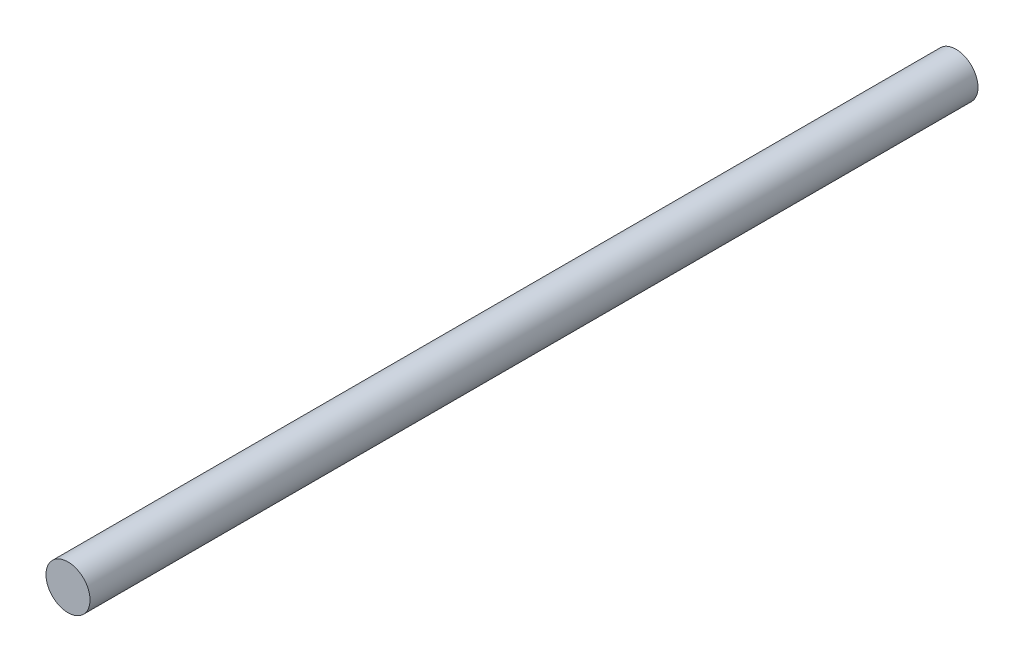
from build123d import *

# Parameters (mm, degrees)
SKETCH2_R           = 1.985
BOSS_EXTRUDE1_DEPTH = 80


with BuildPart() as part:
    # Sketch2 → Boss-Extrude1 (new body)
    with BuildSketch(Plane.XY):
        Circle(SKETCH2_R)
    extrude(amount=BOSS_EXTRUDE1_DEPTH)


solid = part.part
